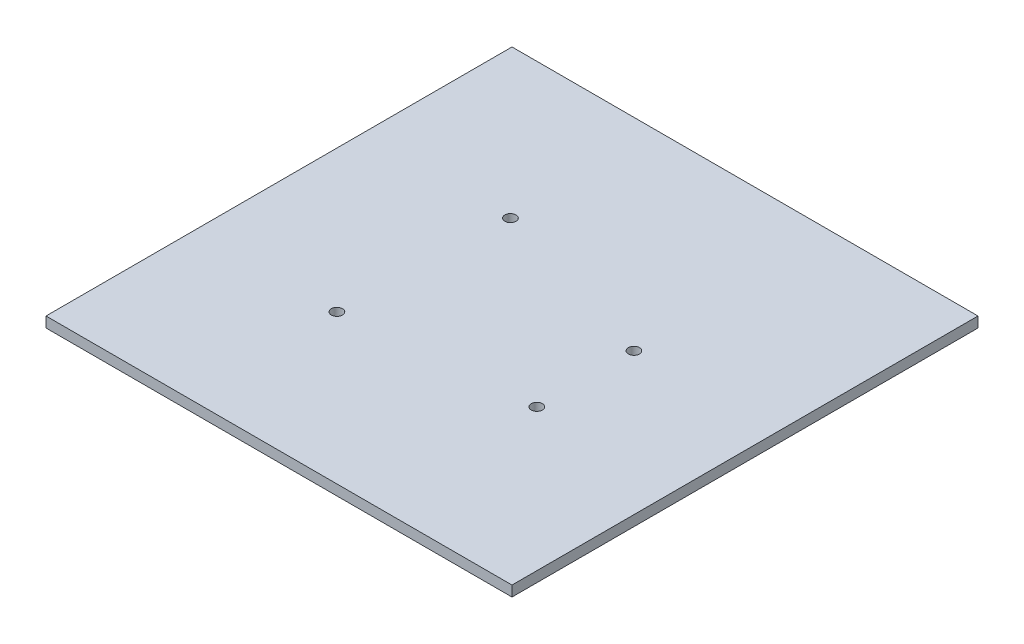
from build123d import *

# Parameters (mm, degrees)
SKETCH2_W           = 134
SKETCH2_H           = 134
SKETCH2_R           = 1.6
BOSS_EXTRUDE2_DEPTH = 3


with BuildPart() as part:
    # Sketch2 → Boss-Extrude2 (new body)
    with BuildSketch(Plane(origin=(0, 0, 0), x_dir=(1, 0, 0), z_dir=(0, 1, 0))):
        Rectangle(SKETCH2_W, SKETCH2_H)
        with Locations(Location((-24.6, 24.15, 0), (0, 0, 270))):
            Circle(SKETCH2_R, mode=Mode.SUBTRACT)
        with Locations(Location((-26.2, -24.15, 0), (0, 0, 270))):
            Circle(SKETCH2_R, mode=Mode.SUBTRACT)
        with Locations(Location((26.2, 8.85, 0), (0, 0, 270))):
            Circle(SKETCH2_R, mode=Mode.SUBTRACT)
        with Locations(Location((26.2, -19.05, 0), (0, 0, 270))):
            Circle(SKETCH2_R, mode=Mode.SUBTRACT)
    extrude(amount=BOSS_EXTRUDE2_DEPTH)


solid = part.part
